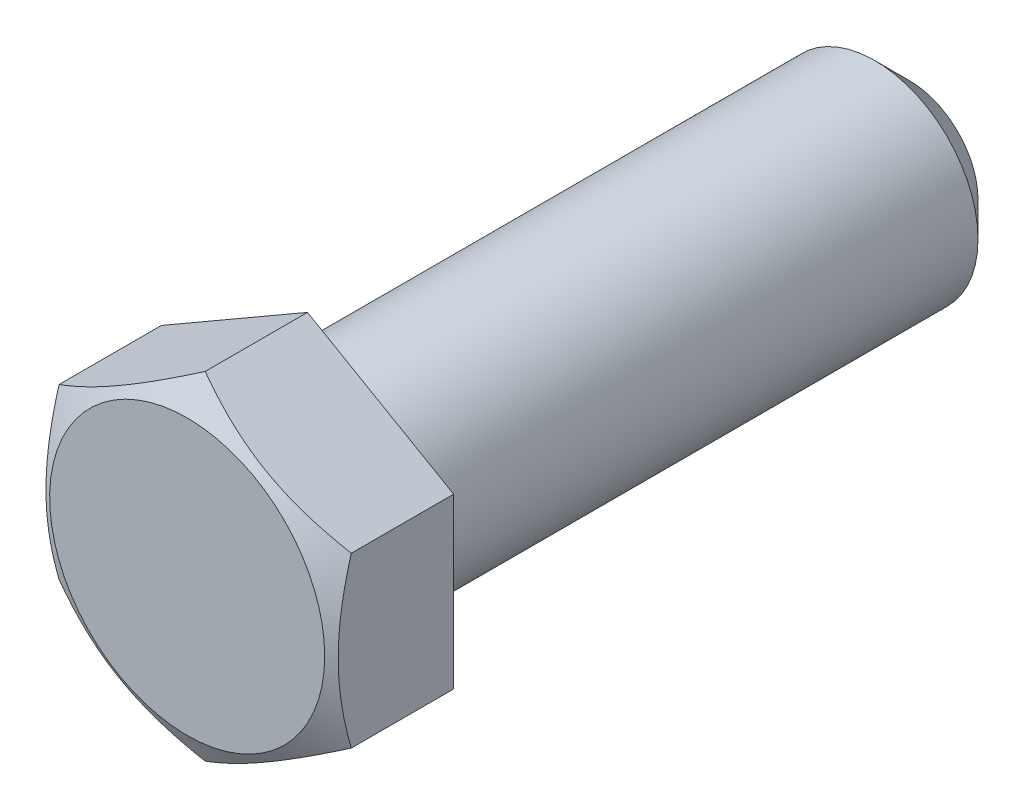
from build123d import *

# Parameters (mm, degrees)
CHAMFER_2_SIZE      = 2
FILLET_2_R          = 0.6
SKETCH_7_OUTSIDE_W  = 32.128
SKETCH_7_OUTSIDE_H  = 32.128
CUT_EXTRUDE_5_DEPTH = 7


with BuildPart() as part:
    # Эскиз1 → Повернуть2 (revolve)
    with BuildSketch(Plane(origin=(0, 0, 0), x_dir=(0, 0, -1), z_dir=(1, 0, 0)), mode=Mode.PRIVATE) as revolve_2_sk:
        Polygon((0, 8), (0, 0), (42, 0), (42, 6), (7, 6), (7, 10), (1.154700538, 10), align=None)
    revolve(revolve_2_sk.sketch.rotate(Axis((0, 0, 0), (0, 0, -1)), 90), axis=Axis((0, 0, 0), (0, 0, -1)))

    # Фаска2
    chamfer_2_edges = [part.edges().sort_by_distance(p)[0] for p in [
        (-6, 0, -42),
    ]]
    chamfer(chamfer_2_edges, length=CHAMFER_2_SIZE)

    # Скругление2
    fillet_2_edges = [part.edges().sort_by_distance(p)[0] for p in [
        (-6, 0, -7),
    ]]
    fillet(fillet_2_edges, radius=FILLET_2_R)

    # Эскиз7 outside → Вырез-Вытянуть5 (cut)
    with BuildSketch(Plane.XY):
        Rectangle(SKETCH_7_OUTSIDE_W, SKETCH_7_OUTSIDE_H)
        Polygon((0, 9.814954576), (-8.5, 4.907477288), (-8.5, -4.907477288), (0, -9.814954576), (8.5, -4.907477288), (8.5, 4.907477288), align=None, mode=Mode.SUBTRACT)
    extrude(amount=-CUT_EXTRUDE_5_DEPTH, mode=Mode.SUBTRACT)


solid = part.part
